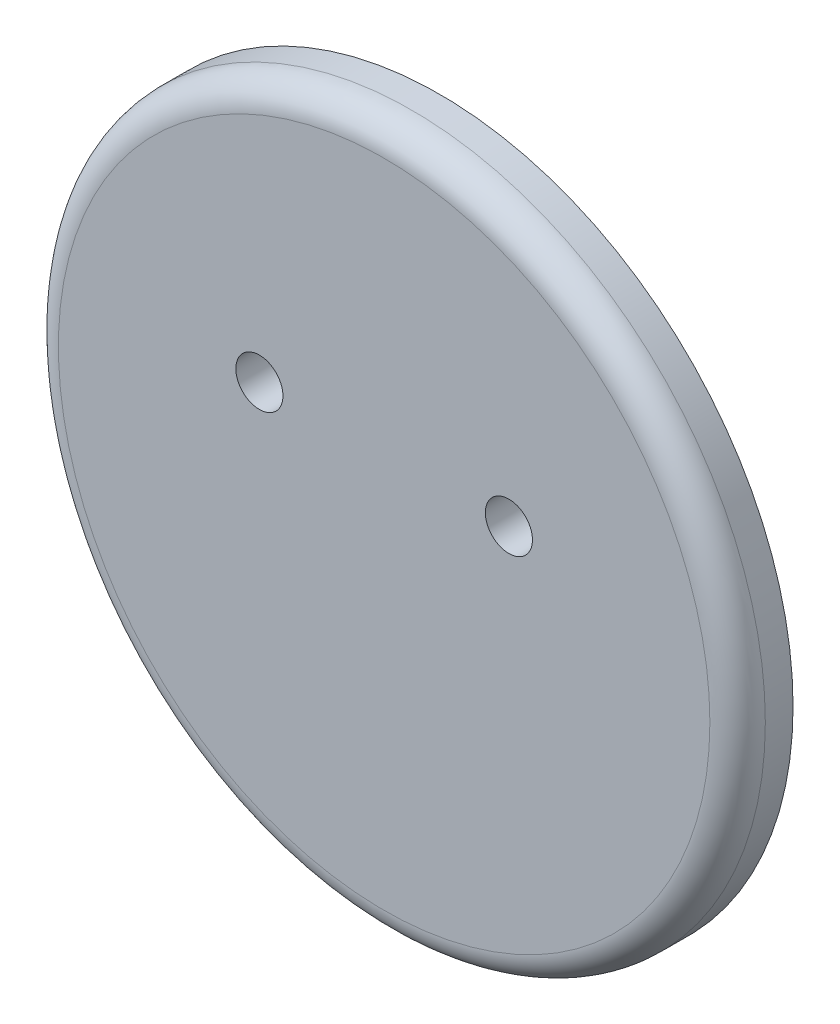
from build123d import *

# Parameters (mm, degrees)
SKETCH1_R           = 25.5
BOSS_EXTRUDE1_DEPTH = 4
SKETCH3_R           = 24.5
SKETCH3_R_2         = 18.5
CUT_EXTRUDE1_DEPTH  = 1.675
FILLET1_R           = 1.5
FILLET2_R           = 2
SKETCH4_R           = 1.7
CUT_EXTRUDE2_DEPTH  = 4


with BuildPart() as part:
    # Sketch1 → Boss-Extrude1 (new body)
    with BuildSketch(Plane.XY):
        Circle(SKETCH1_R)
    extrude(amount=BOSS_EXTRUDE1_DEPTH)

    # Sketch3 → Cut-Extrude1 (cut)
    with BuildSketch(Plane(origin=(0, 0, 0), x_dir=(-1, 0, 0), z_dir=(0, 0, -1))):
        Circle(SKETCH3_R)
        Circle(SKETCH3_R_2, mode=Mode.SUBTRACT)
    extrude(amount=-CUT_EXTRUDE1_DEPTH, mode=Mode.SUBTRACT)

    # Fillet1
    fillet1_edges = [part.edges().sort_by_distance(p)[0] for p in [
        (24.5, 0, 1.675),
        (18.5, 0, 1.675),
    ]]
    fillet(fillet1_edges, radius=FILLET1_R)

    # Fillet2
    fillet2_edges = [part.edges().sort_by_distance(p)[0] for p in [
        (-25.5, 0, 4),
    ]]
    fillet(fillet2_edges, radius=FILLET2_R)

    # Sketch4 → Cut-Extrude2 (cut)
    with BuildSketch(Plane(origin=(0, 0, 0), x_dir=(-1, 0, 0), z_dir=(0, 0, -1))):
        with Locations((-9, 5)):
            Circle(SKETCH4_R)
        with Locations((9, 5)):
            Circle(SKETCH4_R)
    extrude(amount=-CUT_EXTRUDE2_DEPTH, mode=Mode.SUBTRACT)


solid = part.part
